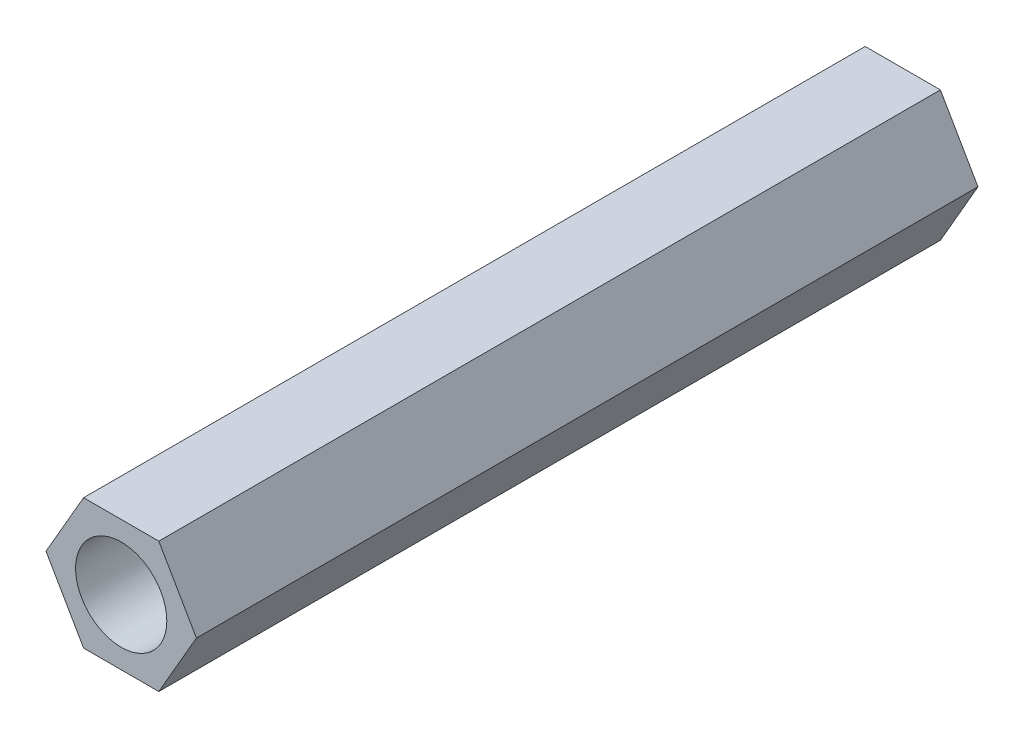
from build123d import *

# Parameters (mm, degrees)
SALIENTE_EXTRUIR1_DEPTH = 30
CROQUIS2_R              = 1.75
CORTAR_EXTRUIR1_DEPTH   = 31.242078853


with BuildPart() as part:
    # Croquis1 → Saliente-Extruir1 (new body)
    with BuildSketch(Plane.XY):
        Polygon((2.886751346, 0), (1.443375673, 2.5), (-1.443375673, 2.5), (-2.886751346, 0), (-1.443375673, -2.5), (1.443375673, -2.5), align=None)
    extrude(amount=SALIENTE_EXTRUIR1_DEPTH)

    # Croquis2 → Cortar-Extruir1 (cut, through all)
    with BuildSketch(Plane.XY.offset(30)):
        Circle(CROQUIS2_R)
    extrude(amount=-CORTAR_EXTRUIR1_DEPTH, mode=Mode.SUBTRACT)


solid = part.part
